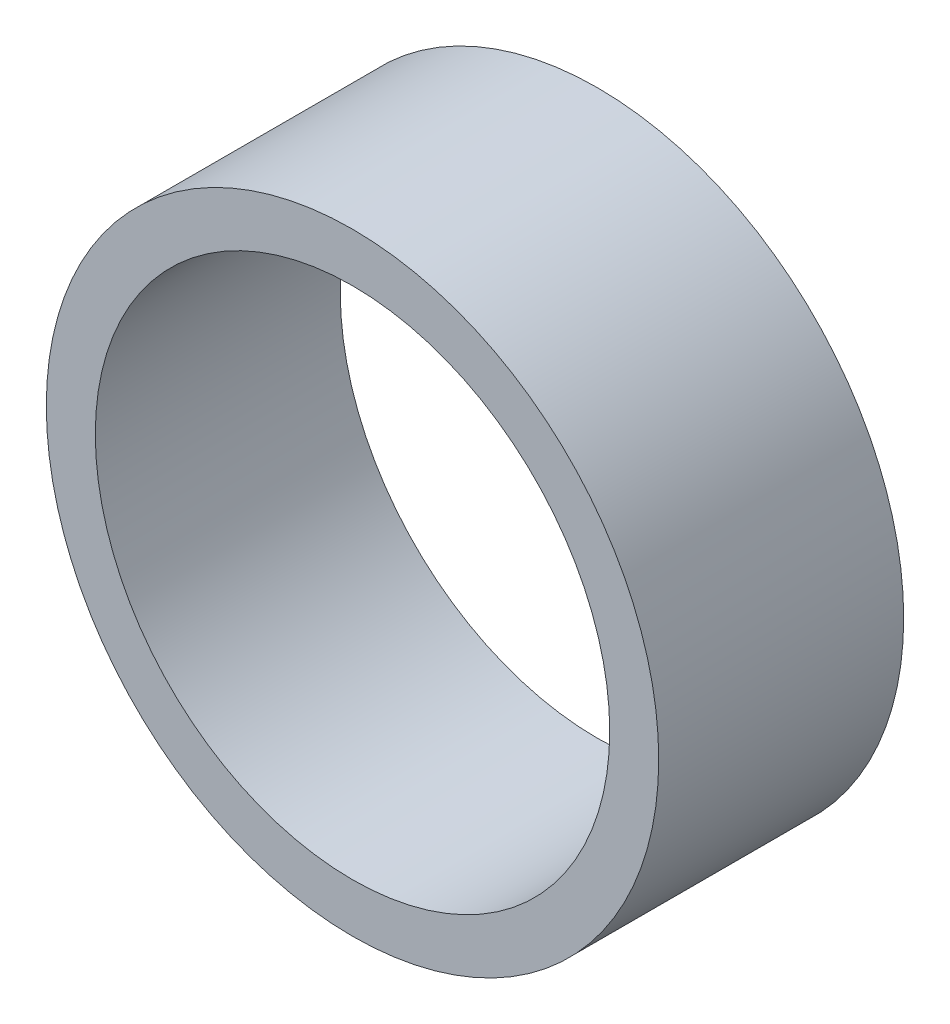
from build123d import *

# Parameters (mm, degrees)
SKETCH1_R           = 5
BOSS_EXTRUDE1_DEPTH = 4
SKETCH3_R           = 4.2
CUT_EXTRUDE1_DEPTH  = 15.716062653


with BuildPart() as part:
    # Sketch1 → Boss-Extrude1 (new body)
    with BuildSketch(Plane.XY):
        with Locations((0, 8.25)):
            Circle(SKETCH1_R)
    extrude(amount=-BOSS_EXTRUDE1_DEPTH)

    # Sketch3 → Cut-Extrude1 (cut, through all)
    with BuildSketch(Plane.XY):
        with Locations((0, 8.25)):
            Circle(SKETCH3_R)
    extrude(amount=-CUT_EXTRUDE1_DEPTH, mode=Mode.SUBTRACT)


solid = part.part
